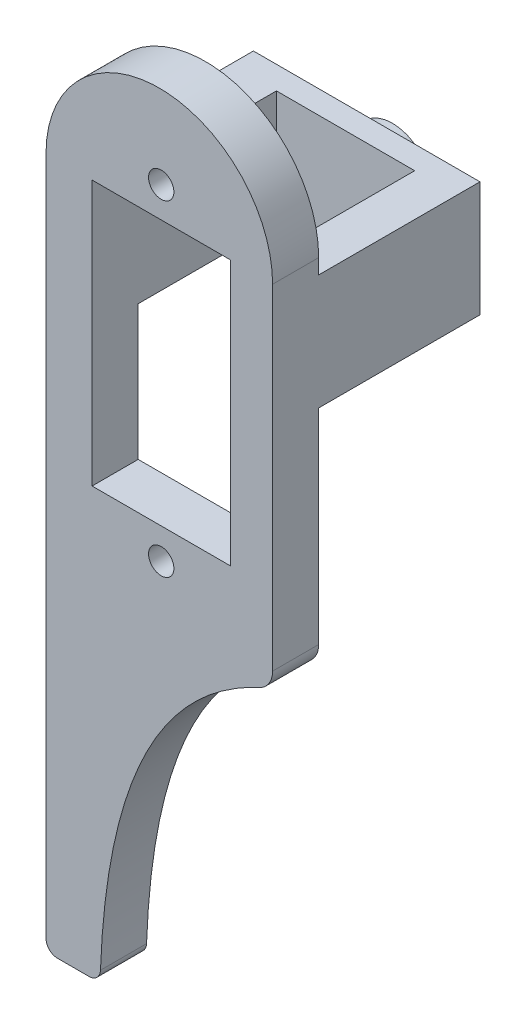
from build123d import *

# Parameters (mm, degrees)
BOSS_EXTRUDE1_DEPTH = 4
CUT_EXTRUDE1_REACH  = 67.872
SKETCH2_R           = 1.1
SKETCH2_W           = 12
SKETCH2_H           = 23
FILLET1_R           = 2
FILLET2_R           = 1
FILLET3_R           = 1
SKETCH3_W           = 3.666320095
SKETCH3_H           = 10
SKETCH3_W_2         = 4
BOSS_EXTRUDE2_DEPTH = 12
SKETCH4_W           = 19.666320095
SKETCH4_H           = 10
BOSS_EXTRUDE3_DEPTH = 2
SKETCH5_R           = 3.4
BOSS_EXTRUDE4_DEPTH = 2


with BuildPart() as part:
    # Sketch1 → Boss-Extrude1 (new body)
    with BuildSketch(Plane.XY):
        with BuildLine():
            Line((10.219576084, 1.434709353), (10.219576084, -58.565290647))
            Line((10.219576084, -58.565290647), (14.921299434, -58.565290647))
            Line((14.921299434, -58.565290647), (14.921299434, -58.307205095))
            add(Edge.make_bspline(
                [(29.885896179, -28.969975988), (15.603913992, -34.528623974), (14.921299434, -58.307205095)],
                knots=[0, 0, 0, 1, 1, 1], degree=2))
            Line((29.885896179, -28.969975988), (29.885896179, 1.434709353))
            ThreePointArc((29.885896179, 1.434709353), (20.052736131, 11.2678694), (10.219576084, 1.434709353))
        make_face()
    extrude(amount=BOSS_EXTRUDE1_DEPTH)

    # Sketch2 → Cut-Extrude1 (cut, up to next)
    with BuildSketch(Plane.XY.offset(4), mode=Mode.PRIVATE) as cut_extrude1_sk1:
        with Locations((20.219576084, 4.084709353)):
            Circle(SKETCH2_R)
    cut_extrude1_tool1 = extrude(cut_extrude1_sk1.sketch, amount=-CUT_EXTRUDE1_REACH, mode=Mode.PRIVATE) & part.part
    # Sketch2 → Cut-Extrude1 (cut, up to next)
    with BuildSketch(Plane.XY.offset(4), mode=Mode.PRIVATE) as cut_extrude1_sk2:
        with Locations((20.219576084, -24.215290647)):
            Circle(SKETCH2_R)
    cut_extrude1_tool2 = extrude(cut_extrude1_sk2.sketch, amount=-CUT_EXTRUDE1_REACH, mode=Mode.PRIVATE) & part.part
    # Sketch2 → Cut-Extrude1 (cut, up to next)
    with BuildSketch(Plane.XY.offset(4), mode=Mode.PRIVATE) as cut_extrude1_sk3:
        with Locations((20.219576084, -10.065290647)):
            Rectangle(SKETCH2_W, SKETCH2_H)
    cut_extrude1_tool3 = extrude(cut_extrude1_sk3.sketch, amount=-CUT_EXTRUDE1_REACH, mode=Mode.PRIVATE) & part.part
    add(cut_extrude1_tool1.solids().sort_by_distance((20.219576, 4.084709, 4))[0], mode=Mode.SUBTRACT)
    add(cut_extrude1_tool2.solids().sort_by_distance((20.219576, -24.215291, 4))[0], mode=Mode.SUBTRACT)
    add(cut_extrude1_tool3.solids().sort_by_distance((20.219576, -10.065291, 4))[0], mode=Mode.SUBTRACT)

    # Fillet1
    fillet1_edges = [part.edges().sort_by_distance(p)[0] for p in [
        (29.885896179, -28.969975988, 2),
    ]]
    fillet(fillet1_edges, radius=FILLET1_R)

    # Fillet2
    fillet2_edges = [part.edges().sort_by_distance(p)[0] for p in [
        (14.921299434, -58.565290647, 2),
    ]]
    fillet(fillet2_edges, radius=FILLET2_R)

    # Fillet3
    fillet3_edges = [part.edges().sort_by_distance(p)[0] for p in [
        (10.219576084, -58.565290647, 2),
    ]]
    fillet(fillet3_edges, radius=FILLET3_R)

    # Sketch3 → Boss-Extrude2 (add)
    with BuildSketch(Plane(origin=(0, 0, 0), x_dir=(-1, 0, 0), z_dir=(0, 0, -1))):
        with Locations((-28.052736132, -4.865290647)):
            Rectangle(SKETCH3_W, SKETCH3_H)
        with Locations((-12.219576084, -4.865290647)):
            Rectangle(SKETCH3_W_2, SKETCH3_H)
    extrude(amount=BOSS_EXTRUDE2_DEPTH)

    # Sketch4 → Boss-Extrude3 (add)
    with BuildSketch(Plane(origin=(0, 0, -12), x_dir=(-1, 0, 0), z_dir=(0, 0, -1))):
        with Locations((-20.052736132, -4.865290647)):
            Rectangle(SKETCH4_W, SKETCH4_H)
    extrude(amount=BOSS_EXTRUDE3_DEPTH)

    # Sketch5 → Boss-Extrude4 (add)
    with BuildSketch(Plane(origin=(0, 0, -14), x_dir=(-1, 0, 0), z_dir=(0, 0, -1))):
        with Locations((-20.285896179, -4.665290647)):
            Circle(SKETCH5_R)
    extrude(amount=BOSS_EXTRUDE4_DEPTH)


solid = part.part
